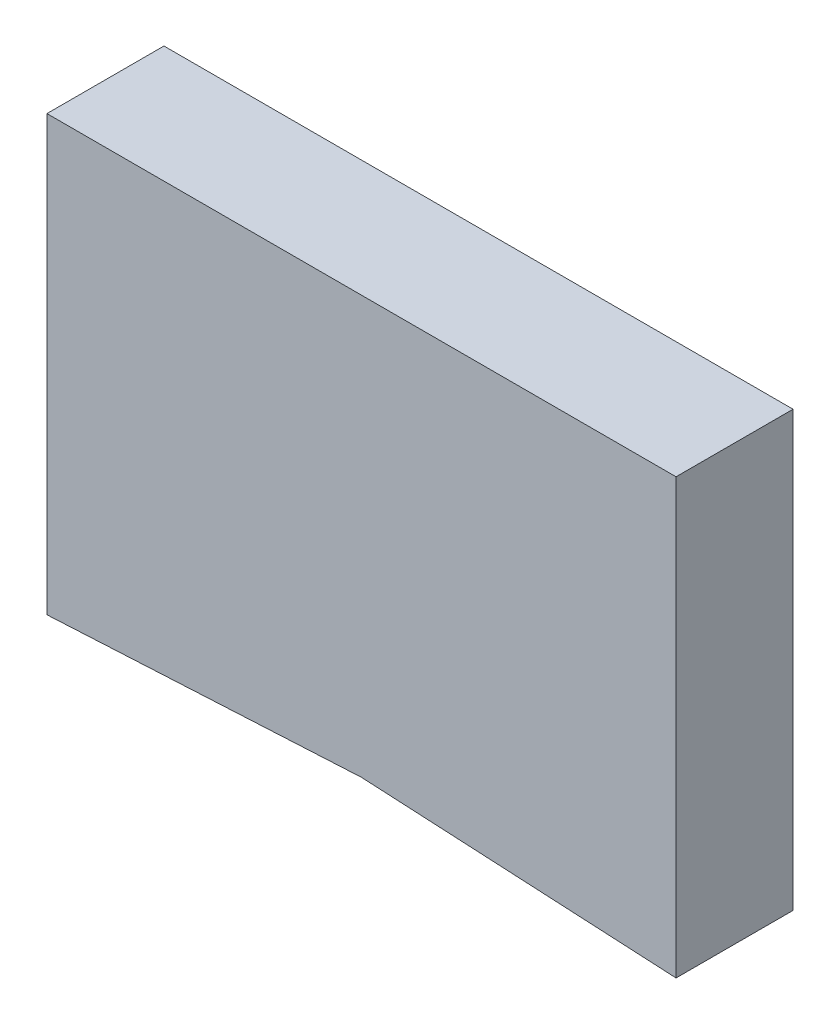
from build123d import *

# Parameters (mm, degrees)
SKETCH1_W           = 80
SKETCH1_H           = 14.88
BOSS_EXTRUDE1_DEPTH = 55.2
CUT_EXTRUDE1_DEPTH  = 70.774310459


with BuildPart() as part:
    # Sketch1 → Boss-Extrude1 (new body)
    with BuildSketch(Plane(origin=(0, 0, 0), x_dir=(1, 0, 0), z_dir=(0, 1, 0))):
        Rectangle(SKETCH1_W, SKETCH1_H)
    extrude(amount=-BOSS_EXTRUDE1_DEPTH)

    # Sketch3 → Cut-Extrude1 (cut, through all)
    with BuildSketch(Plane(origin=(0, 0, -7.44), x_dir=(-1, 0, 0), z_dir=(0, 0, -1))):
        Polygon((40, -55.2), (0, -53.103688829), (-40, -55.2), align=None)
    extrude(amount=-CUT_EXTRUDE1_DEPTH, mode=Mode.SUBTRACT)


solid = part.part
